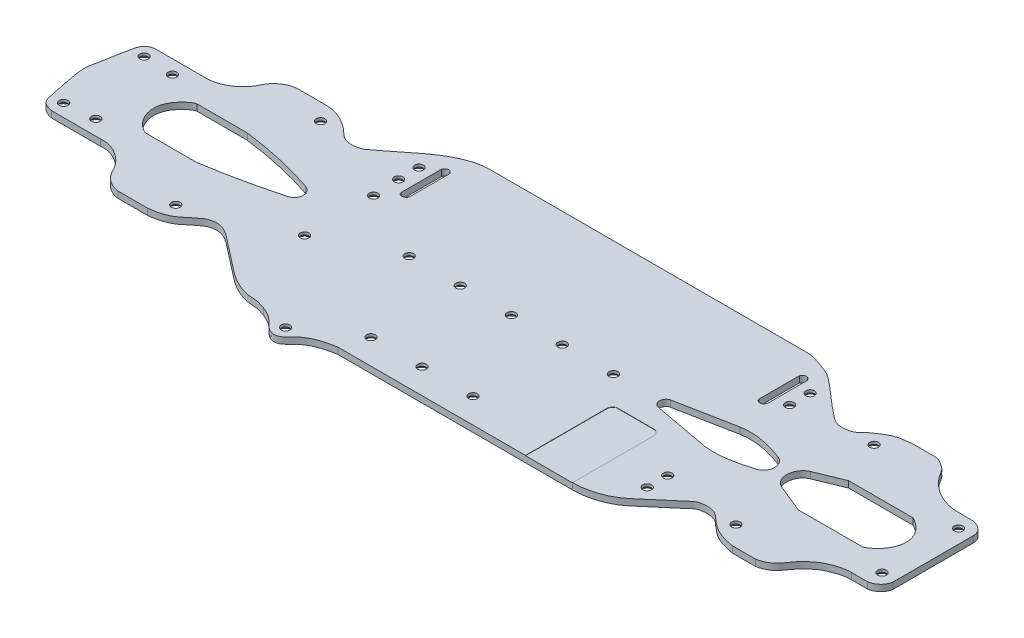
from build123d import *

# Parameters (mm, degrees)
SKETCH1_R                                      = 1.5
BOSS_EXTRUDE2_DEPTH                            = 2.5
CUT_EXTRUDE1_DEPTH                             = 0.1
CSK_FOR_M3_FLAT_HEAD_MACHINE_SCREW4_AT_2_COUNT = 2
CSK_FOR_M3_FLAT_HEAD_MACHINE_SCREW4_AT_2_PITCH = 66.233696107
CSK_FOR_M3_FLAT_HEAD_MACHINE_SCREW4_AT_3_COUNT = 2
CSK_FOR_M3_FLAT_HEAD_MACHINE_SCREW4_AT_3_PITCH = 59.212350908
CSK_FOR_M3_FLAT_HEAD_MACHINE_SCREW4_AT_4_COUNT = 2
CSK_FOR_M3_FLAT_HEAD_MACHINE_SCREW4_AT_4_PITCH = 30.175528164
CSK_FOR_M3_FLAT_HEAD_MACHINE_SCREW4_AT_5_COUNT = 2
CSK_FOR_M3_FLAT_HEAD_MACHINE_SCREW4_AT_5_PITCH = 30.373713965
CSK_FOR_M3_FLAT_HEAD_MACHINE_SCREW4_AT_6_COUNT = 2
CSK_FOR_M3_FLAT_HEAD_MACHINE_SCREW4_AT_6_PITCH = 79.728931386
CSK_FOR_M3_FLAT_HEAD_MACHINE_SCREW4_AT_7_COUNT = 2
CSK_FOR_M3_FLAT_HEAD_MACHINE_SCREW4_AT_7_PITCH = 95.332064385
CSK_FOR_M3_FLAT_HEAD_MACHINE_SCREW5_AT_2_COUNT = 2
CSK_FOR_M3_FLAT_HEAD_MACHINE_SCREW5_AT_2_PITCH = 40.263909088
CSK_FOR_M3_FLAT_HEAD_MACHINE_SCREW5_AT_3_COUNT = 2
CSK_FOR_M3_FLAT_HEAD_MACHINE_SCREW5_AT_3_PITCH = 20.000074474
CSK_FOR_M3_FLAT_HEAD_MACHINE_SCREW5_AT_4_COUNT = 2
CSK_FOR_M3_FLAT_HEAD_MACHINE_SCREW5_AT_4_PITCH = 40.000037237
CSK_FOR_M3_FLAT_HEAD_MACHINE_SCREW5_AT_5_COUNT = 2
CSK_FOR_M3_FLAT_HEAD_MACHINE_SCREW5_AT_5_PITCH = 53.114803727
CSK_FOR_M3_FLAT_HEAD_MACHINE_SCREW5_AT_6_COUNT = 2
CSK_FOR_M3_FLAT_HEAD_MACHINE_SCREW5_AT_6_PITCH = 77.053745071
CSK_FOR_M3_FLAT_HEAD_MACHINE_SCREW5_AT_7_COUNT = 2
CSK_FOR_M3_FLAT_HEAD_MACHINE_SCREW5_AT_7_PITCH = 60.000024825
CSK_FOR_M3_FLAT_HEAD_MACHINE_SCREW5_AT_8_COUNT = 2
CSK_FOR_M3_FLAT_HEAD_MACHINE_SCREW5_AT_8_PITCH = 88.519417505
CSK_FOR_M3_FLAT_HEAD_MACHINE_SCREW5_AT_9_COUNT = 2
CSK_FOR_M3_FLAT_HEAD_MACHINE_SCREW5_AT_9_PITCH = 88.551310541
CSK_FOR_M3_FLAT_HEAD_MACHINE_SCREW5_AT_1_COUNT = 2
CSK_FOR_M3_FLAT_HEAD_MACHINE_SCREW5_AT_1_PITCH = 91.311718107
CSK_FOR_M3_FLAT_HEAD_MACHINE_SCREW5_2_COUNT    = 2
CSK_FOR_M3_FLAT_HEAD_MACHINE_SCREW5_2_PITCH    = 93.73314859
CSK_FOR_M3_FLAT_HEAD_MACHINE_SCREW5_3_COUNT    = 2
CSK_FOR_M3_FLAT_HEAD_MACHINE_SCREW5_3_PITCH    = 126.345847285
CSK_FOR_M3_FLAT_HEAD_MACHINE_SCREW5_4_COUNT    = 2
CSK_FOR_M3_FLAT_HEAD_MACHINE_SCREW5_4_PITCH    = 126.29890636
CSK_FOR_M3_FLAT_HEAD_MACHINE_SCREW5_5_COUNT    = 2
CSK_FOR_M3_FLAT_HEAD_MACHINE_SCREW5_5_PITCH    = 168.546246941
CSK_FOR_M3_FLAT_HEAD_MACHINE_SCREW5_6_COUNT    = 2
CSK_FOR_M3_FLAT_HEAD_MACHINE_SCREW5_6_PITCH    = 168.591554551
CSK_FOR_M3_FLAT_HEAD_MACHINE_SCREW5_7_COUNT    = 2
CSK_FOR_M3_FLAT_HEAD_MACHINE_SCREW5_7_PITCH    = 180.298440672
CSK_FOR_M3_FLAT_HEAD_MACHINE_SCREW5_8_COUNT    = 2
CSK_FOR_M3_FLAT_HEAD_MACHINE_SCREW5_8_PITCH    = 180.28016853


with BuildPart() as part:
    # Sketch1 → Boss-Extrude2 (new body)
    # profile 1 of 35: a face of its own
    with BuildSketch(Plane(origin=(0, 0, 0), x_dir=(1, 0, 0), z_dir=(0, 1, 0))):
        with BuildLine():
            add(Edge.make_bspline(
                [(36.907488585, 54.882422047), (35.594519657, 54.56401607), (33.799338122, 52.976536828), (31.098345546, 50.096988021), (30.009509433, 47.212874354), (29.911704123, 45.283867027), (29.911219993, 44.969957828)],
                knots=[0, 0, 0, 0, 0.154255371, 0.275824704, 0.463552703, 0.499989342, 0.499989342, 0.499989342, 0.499989342], degree=3))
            Line((36.907488585, 54.882422047), (56.618968262, 54.882422047))
            add(Edge.make_bspline(
                [(56.618968262, 54.882422047), (71.670703859, 53.032810637), (86.062948094, 48.228182501)],
                knots=[0, 0, 0, 1, 1, 1], degree=2))
            add(Edge.make_bspline(
                [(86.062948094, 48.228182501), (86.868819756, 47.891547415), (88.223487764, 47.030286074), (88.720704191, 45.523685137), (88.757007412, 44.90847658)],
                knots=[0, 0, 0, 0, 0.28626646, 0.481455552, 0.481455552, 0.481455552, 0.481455552], degree=3))
            Line((88.757007412, 44.90847658), (128.601490275, 44.866847627))
            ThreePointArc((128.601490275, 44.866847627), (130.101567178, 46.299999181), (131.598646136, 44.863716241))
            Line((131.598646136, 44.863716241), (148.60070405, 44.845952731))
            ThreePointArc((148.60070405, 44.845952731), (150.101567178, 46.299999181), (151.599388699, 44.842819748))
            Line((151.599388699, 44.842819748), (168.600209308, 44.82505753))
            ThreePointArc((168.600209308, 44.82505753), (170.101567178, 46.299999181), (171.599839777, 44.821923559))
            Line((171.599839777, 44.821923559), (188.601150605, 44.804160829))
            ThreePointArc((188.601150605, 44.804160829), (190.101567178, 46.245419125), (191.598968866, 44.801028751))
            Line((191.598968866, 44.801028751), (208.600093343, 44.783266216))
            ThreePointArc((208.600093343, 44.783266216), (210.091632978, 46.299976664), (211.6, 44.8))
            ThreePointArc((211.6, 44.8), (211.599967104, 44.790065829), (211.599868416, 44.780132094))
            Line((211.599868416, 44.780132094), (228.147766177, 44.762843084))
            add(Edge.make_bspline(
                [(230.075858638, 47.193938188), (228.966952353, 46.987709042), (228.151485642, 45.873605381), (228.147766177, 44.762843084)],
                knots=[0, 0, 0, 0, 0.499360617, 0.499360617, 0.499360617, 0.499360617], degree=3))
            Line((230.075858638, 47.193938188), (252.784902126, 51.623620635))
            add(Edge.make_bspline(
                [(252.784902126, 51.623620635), (258.653577095, 52.670158948), (264.694447743, 50.965840037), (270.160470774, 49.009789661)],
                knots=[0, 0, 0, 0, 1, 1, 1, 1], degree=3))
            add(Edge.make_bspline(
                [(270.160470774, 49.009789661), (272.115204978, 48.467545141), (273.263365656, 46.599497688), (273.300093974, 44.715668569)],
                knots=[0, 0, 0, 0, 0.530351687, 0.530351687, 0.530351687, 0.530351687], degree=3))
            Line((273.300093974, 44.715668569), (278.1012549, 44.710652384))
            add(Edge.make_bspline(
                [(281.657342501, 50.311284728), (279.488273035, 49.414407256), (278.159258638, 47.062632602), (278.1012549, 44.710652384)],
                knots=[0, 0, 0, 0, 0.515708483, 0.515708483, 0.515708483, 0.515708483], degree=3))
            Line((281.657342501, 50.311284728), (292.311176152, 54.684119913))
            Line((292.311176152, 54.684119913), (317.525221457, 54.684119913))
            add(Edge.make_bspline(
                [(317.525221457, 54.684119913), (320.088023343, 53.418859666), (323.5801233, 50.408576421), (324.485491537, 46.071064208), (324.441891448, 44.712447016), (324.43983088, 44.662238494)],
                knots=[0, 0, 0, 0, 0.34763493, 0.503597702, 0.509586391, 0.509586391, 0.509586391, 0.509586391], degree=3))
            Line((324.43983088, 44.662238494), (335.337556727, 44.650852704))
            Line((335.337556727, 44.650852704), (335.337556727, 60.267166852))
            add(Edge.make_bspline(
                [(335.337556727, 60.267166852), (335.381647502, 64.063012087), (330.550085447, 65.420877221)],
                knots=[0, 0, 0, 1, 1, 1], degree=2))
            Line((330.550085447, 65.420877221), (323.870194658, 65.420877221))
            add(Edge.make_bspline(
                [(323.870194658, 65.420877221), (317.619104204, 65.56499295), (310.705850331, 69.83589089), (307.210641289, 76.198281564), (306.209643656, 77.295852609), (304.098545391, 78.764500401), (302.146747599, 79.934271199), (300.184758452, 79.721925355)],
                knots=[0, 0, 0, 0, 0.659856766, 0.730605099, 0.761699658, 0.815046018, 1, 1, 1, 1], degree=3))
            Line((300.184758452, 79.721925355), (292.311176152, 79.721925355))
            add(Edge.make_bspline(
                [(292.311176152, 79.721925355), (290.515866117, 79.532186233), (287.650872868, 79.285674879), (284.335781016, 77.834435105), (282.245880387, 76.481570477), (280.384831269, 75.294035196), (278.843910446, 73.942010968), (277.210811913, 72.22384044), (274.597389491, 71.491452203), (270.315204299, 71.198863613), (266.93581452, 74.269012769), (263.766328693, 76.706339683), (259.904133267, 80.208532645), (255.949839215, 83.596042356), (251.532307332, 86.906413114), (247.154791102, 88.449470967), (243.863905973, 89.760044875), (241.412578053, 89.987527163)],
                knots=[0, 0, 0, 0, 0.09283743, 0.14417525, 0.182810682, 0.219899914, 0.256495407, 0.287499878, 0.338956732, 0.390177904, 0.499998535, 0.551882987, 0.59706118, 0.764972191, 0.818812135, 0.876527075, 1, 1, 1, 1], degree=3))
            Line((241.412578053, 89.987527163), (116.392245976, 89.987527163))
            add(Edge.make_bspline(
                [(116.392245976, 89.987527163), (111.123803127, 89.915101741), (99.565741074, 84.787056532), (90.747410554, 76.147271316), (84.729685527, 72.011409224), (84.086237478, 71.812634222), (82.597533065, 71.351128856), (80.506216641, 71.180000703), (77.918056694, 71.729979428), (75.811657805, 73.397939488), (73.885099613, 75.321199149), (71.587400482, 76.908460503), (67.939586985, 78.963876819), (64.500177104, 79.806330829), (62.105756261, 79.725856712)],
                knots=[0, 0, 0, 0, 0.251239563, 0.591866674, 0.594713988, 0.603634623, 0.624034773, 0.670441718, 0.703262581, 0.749584159, 0.7972553, 0.835488746, 0.884027354, 1, 1, 1, 1], degree=3))
            Line((62.105756261, 79.725856712), (51.430035292, 79.725856712))
            add(Edge.make_bspline(
                [(51.430035292, 79.725856712), (48.916189055, 79.589946172), (45.895678105, 77.953052682), (43.366487698, 74.792985664), (42.523557941, 72.734485387), (39.095452586, 67.797623836), (34.015093498, 65.233723332), (29.460885553, 65.375610013)],
                knots=[0, 0, 0, 0, 0.273781437, 0.345825108, 0.439759411, 0.514564325, 1, 1, 1, 1], degree=3))
            Line((29.460885553, 65.375610013), (9.942760218, 65.375610013))
            add(Edge.make_bspline(
                [(9.942760218, 65.375610013), (9.179694159, 65.260483529), (7.421029287, 64.823378952), (5.875551354, 62.343291218), (5.213472185, 58.738361169), (4.525047277, 55.004597997), (3.667263698, 50.20010987), (2.897120538, 47.11320988), (2.840662331, 44.998240764)],
                knots=[0, 0, 0, 0, 0.050551914, 0.108721261, 0.174134793, 0.286411335, 0.351533713, 0.487562398, 0.487562398, 0.487562398, 0.487562398], degree=3))
            Line((2.840662331, 44.998240764), (29.911219993, 44.969957828))
        make_face()
        with Locations((10.5, 60.6)):
            Circle(SKETCH1_R, mode=Mode.SUBTRACT)
        with Locations((22.2, 60.00000174)):
            Circle(SKETCH1_R, mode=Mode.SUBTRACT)
        with Locations((102.6, 58.35)):
            Circle(SKETCH1_R, mode=Mode.SUBTRACT)
        with Locations((67, 73.2)):
            Circle(SKETCH1_R, mode=Mode.SUBTRACT)
        with Locations((102, 68.75)):
            Circle(SKETCH1_R, mode=Mode.SUBTRACT)
        with Locations((102, 76.75)):
            Circle(SKETCH1_R, mode=Mode.SUBTRACT)
        with BuildLine():
            Line((106.952300587, 64.863549186), (106.952300587, 80.666234777))
            add(Edge.make_bspline(
                [(106.952300587, 80.666234777), (107.178026488, 81.313115102), (108.564834934, 82.386014195), (109.877039864, 81.274789213), (110.060580104, 80.666234777)],
                knots=[0, 0, 0, 0, 0.518454887, 1, 1, 1, 1], degree=3))
            Line((110.060580104, 80.666234777), (110.060580104, 64.863549186))
            add(Edge.make_bspline(
                [(106.952300587, 64.863549186), (106.930386217, 64.303836762), (107.587346629, 63.70701542), (109.024356388, 63.566667525), (109.846624254, 64.249851069), (110.060580104, 64.863549186)],
                knots=[0, 0, 0, 0, 0.365316911, 0.535858605, 1, 1, 1, 1], degree=3))
        make_face(mode=Mode.SUBTRACT)
        with Locations((330, 60)):
            Circle(SKETCH1_R, mode=Mode.SUBTRACT)
        with BuildLine():
            Line((247.043811407, 64.863549186), (247.043811407, 80.666234777))
            add(Edge.make_bspline(
                [(247.043811407, 80.666234777), (247.30363071, 81.24405282), (248.717614816, 82.483580171), (249.929593053, 81.160687442), (250.187116738, 80.666234777)],
                knots=[0, 0, 0, 0, 0.528438548, 1, 1, 1, 1], degree=3))
            Line((250.187116738, 80.666234777), (250.187116738, 64.863549186))
            add(Edge.make_bspline(
                [(247.043811407, 64.863549186), (247.182148453, 64.156618314), (247.911677614, 63.667059472), (249.361001183, 63.591096243), (249.860698355, 64.495451031), (250.187116738, 64.863549186)],
                knots=[0, 0, 0, 0, 0.451332801, 0.577501736, 1, 1, 1, 1], degree=3))
        make_face(mode=Mode.SUBTRACT)
        with Locations((255.1, 68.8)):
            Circle(SKETCH1_R, mode=Mode.SUBTRACT)
        with Locations((255.1, 76.8)):
            Circle(SKETCH1_R, mode=Mode.SUBTRACT)
        with Locations((285.1, 71.85)):
            Circle(SKETCH1_R, mode=Mode.SUBTRACT)
    # profile 2 of 35: a face of its own
    with BuildSketch(Plane(origin=(0, 0, 0), x_dir=(1, 0, 0), z_dir=(0, 1, 0))):
        with BuildLine():
            add(Edge.make_bspline(
                [(29.911219993, 44.969957828), (29.904576398, 40.66226236), (32.800514525, 36.286690819), (36.907488585, 34.941785883)],
                knots=[0.499989342, 0.499989342, 0.499989342, 0.499989342, 1, 1, 1, 1], degree=3))
            Line((29.911219993, 44.969957828), (2.840662331, 44.998240764))
            add(Edge.make_bspline(
                [(2.840662331, 44.998240764), (2.807126594, 43.741965537), (3.095512667, 40.940086835), (4.474371186, 35.151218845), (5.069956698, 30.241003172), (6.63942442, 25.233263418), (9.254487865, 24.348293786), (10.745376335, 24.11459673)],
                knots=[0.487562398, 0.487562398, 0.487562398, 0.487562398, 0.568362381, 0.666392515, 0.86913624, 0.884827388, 1, 1, 1, 1], degree=3))
            Line((10.745376335, 24.11459673), (29.959567598, 24.11459673))
            add(Edge.make_bspline(
                [(29.959567598, 24.11459673), (32.403489975, 24.410099189), (36.070094818, 23.162399739), (40.586098003, 19.783442662), (42.506610514, 17.112962529), (43.243116967, 15.336715267)],
                knots=[0, 0, 0, 0, 0.430733706, 0.657674038, 1, 1, 1, 1], degree=3))
            add(Edge.make_bspline(
                [(43.243116967, 15.336715267), (43.785762882, 14.408733125), (45.708346841, 11.698957861), (48.83105023, 10.146084088), (51.020872515, 9.853211756)],
                knots=[0, 0, 0, 0, 0.328355163, 1, 1, 1, 1], degree=3))
            Line((51.020872515, 9.853211756), (62.554793295, 9.853211756))
            add(Edge.make_bspline(
                [(62.554793295, 9.853211756), (65.1520941, 10.09298721), (70.440020772, 11.254067041), (74.80599231, 15.730321331), (78.348452154, 18.047170805), (80.644397283, 18.411894734), (83.209459526, 18.329277997), (86.992635719, 16.413767321), (91.318616455, 12.669648109), (97.423172546, 8.159685856), (103.854698474, 2.660261878), (110.746513832, -0.097973795), (116.056689936, -0.085480028), (118.06354319, -1.049572308), (119.270928261, -1.339607968)],
                knots=[0, 0, 0, 0, 0.123327514, 0.237859837, 0.286112953, 0.315953685, 0.344320467, 0.404092563, 0.506753476, 0.610975569, 0.755967955, 0.899756711, 0.941962034, 1, 1, 1, 1], degree=3))
            add(Edge.make_bspline(
                [(119.270928261, -1.339607968), (121.355335254, -2.092163936), (123.970193737, -3.670713855), (126.552628945, -6.582493894), (128.234855066, -7.977777897), (130.438922612, -8.357035387), (132.122434415, -7.878450321), (133.832225295, -6.352336358), (137.563233554, -2.122756115), (143.104162216, -0.62280803), (147.062994102, -0.012472837)],
                knots=[0, 0, 0, 0, 0.20753547, 0.273274937, 0.364647183, 0.401236272, 0.478196474, 0.516217032, 0.613575572, 1, 1, 1, 1], degree=3))
            Line((147.062994102, -0.012472837), (220.450170586, -0.012472837))
            Line((220.450170586, -0.012472837), (220.450170586, 31.35))
            add(Edge.make_bspline(
                [(220.450170586, 31.35), (220.262122398, 33.207542057), (222, 34.056626768)],
                knots=[0, 0, 0, 1, 1, 1], degree=2))
            Line((222, 34.056626768), (237, 34.056626768))
            add(Edge.make_bspline(
                [(238.915198673, 31.35), (239.113985195, 33.403570018), (237, 34.056626768)],
                knots=[0, 0, 0, 1, 1, 1], degree=2))
            Line((238.915198673, 31.35), (238.915198673, -0.012472837))
            add(Edge.make_bspline(
                [(238.915198673, -0.012472837), (242.569073227, -0.057882886), (247.677972276, 1.047616803), (253.755028107, 4.222157183), (257.448994604, 7.372771258), (262.181477481, 11.553780238), (266.245737396, 14.828232566), (269.380468374, 17.734835519), (271.409691776, 18.231607091), (273.224746663, 18.430418914), (275.003863453, 18.210124953), (276.560628972, 17.801862819), (277.979439546, 16.876030769), (279.296710787, 15.752131157), (280.613335618, 14.503593029), (282.086292338, 13.287334144), (283.89358291, 12.194708513), (286.985868363, 10.752391105), (289.675492299, 10.208734179), (291.551206241, 9.853211756)],
                knots=[0, 0, 0, 0, 0.180867461, 0.249761684, 0.33779936, 0.419905234, 0.561880518, 0.598784303, 0.626795677, 0.663132007, 0.688825672, 0.715104021, 0.741927087, 0.771676094, 0.800829534, 0.831669371, 0.865958698, 0.90501028, 1, 1, 1, 1], degree=3))
            Line((291.551206241, 9.853211756), (300.593517722, 9.853211756))
            add(Edge.make_bspline(
                [(300.593517722, 9.853211756), (301.515930843, 9.991946943), (303.576758205, 10.656319662), (306.087291732, 12.230352829), (308.231868929, 15.26731262), (310.076702097, 17.999636552), (312.75378581, 20.049541837), (314.548448054, 21.471628153), (316.716265315, 22.442876805), (318.746853968, 23.290645605), (321.20967663, 23.963664783), (322.883615351, 24.117267848), (323.918700913, 24.118634772)],
                knots=[0, 0, 0, 0, 0.097851721, 0.229649662, 0.302406947, 0.489627767, 0.573653467, 0.657740668, 0.730731757, 0.823622625, 0.890488858, 1, 1, 1, 1], degree=3))
            Line((323.918700913, 24.118634772), (330.304230382, 24.118634772))
            add(Edge.make_bspline(
                [(330.304230382, 24.118634772), (332.751189148, 24.517348713), (334.941799919, 26.345921971), (335.337556727, 29.034538557)],
                knots=[0, 0, 0, 0, 1, 1, 1, 1], degree=3))
            Line((335.337556727, 29.034538557), (335.337556727, 44.650852704))
            Line((335.337556727, 44.650852704), (324.43983088, 44.662238494))
            add(Edge.make_bspline(
                [(324.43983088, 44.662238494), (324.27109099, 40.550663495), (321.095989495, 36.645788539), (317.525221457, 34.941785883)],
                knots=[0.509586391, 0.509586391, 0.509586391, 0.509586391, 1, 1, 1, 1], degree=3))
            Line((317.525221457, 34.941785883), (292.311176152, 34.941785883))
            Line((292.311176152, 34.941785883), (281.657342501, 39.288715272))
            add(Edge.make_bspline(
                [(278.1012549, 44.710652384), (278.04678475, 42.501954822), (279.113182334, 40.29307598), (281.657342501, 39.288715272)],
                knots=[0.515708483, 0.515708483, 0.515708483, 0.515708483, 1, 1, 1, 1], degree=3))
            Line((278.1012549, 44.710652384), (273.300093974, 44.715668569))
            add(Edge.make_bspline(
                [(273.300093974, 44.715668569), (273.332618416, 43.047460117), (272.493576093, 41.366875946), (270.57126488, 40.583629854)],
                knots=[0.530351687, 0.530351687, 0.530351687, 0.530351687, 1, 1, 1, 1], degree=3))
            add(Edge.make_bspline(
                [(252.784902126, 38.123620635), (258.796983293, 37.370186281), (264.845980862, 38.868396789), (270.57126488, 40.583629854)],
                knots=[0, 0, 0, 0, 1, 1, 1, 1], degree=3))
            Line((252.784902126, 38.123620635), (230.075858638, 42.326524066))
            add(Edge.make_bspline(
                [(228.147766177, 44.762843084), (228.147763262, 44.761972429), (228.144672178, 43.648368312), (228.957899469, 42.538840601), (230.075858638, 42.326524066)],
                knots=[0.499360617, 0.499360617, 0.499360617, 0.499360617, 0.499752034, 1, 1, 1, 1], degree=3))
            Line((228.147766177, 44.762843084), (211.599868416, 44.780132094))
            ThreePointArc((211.599868416, 44.780132094), (210.098432822, 43.300000819), (208.600093343, 44.783266216))
            Line((208.600093343, 44.783266216), (191.598968866, 44.801028751))
            ThreePointArc((191.598968866, 44.801028751), (191.599742194, 44.773229127), (191.6, 44.745419943))
            ThreePointArc((191.6, 44.745419943), (190.070623923, 43.245707622), (188.601150605, 44.804160829))
            Line((188.601150605, 44.804160829), (171.599839777, 44.821923559))
            ThreePointArc((171.599839777, 44.821923559), (171.599959944, 44.810962072), (171.6, 44.8))
            ThreePointArc((171.6, 44.8), (170.087470798, 43.300052328), (168.600209308, 44.82505753))
            Line((168.600209308, 44.82505753), (151.599388699, 44.842819748))
            ThreePointArc((151.599388699, 44.842819748), (151.599847167, 44.821412056), (151.6, 44.8))
            ThreePointArc((151.6, 44.8), (150.077020938, 43.300176023), (148.60070405, 44.845952731))
            Line((148.60070405, 44.845952731), (131.598646136, 44.863716241))
            ThreePointArc((131.598646136, 44.863716241), (131.599661496, 44.831865311), (131.6, 44.8))
            ThreePointArc((131.6, 44.8), (130.066567881, 43.300372615), (128.601490275, 44.866847627))
            Line((128.601490275, 44.866847627), (88.757007412, 44.90847658))
            add(Edge.make_bspline(
                [(88.757007412, 44.90847658), (88.761107681, 44.838991828), (88.807960384, 43.203289273), (87.668948693, 41.617492687), (86.062948094, 41.228182501)],
                knots=[0.481455552, 0.481455552, 0.481455552, 0.481455552, 0.503501191, 1, 1, 1, 1], degree=3))
            add(Edge.make_bspline(
                [(56.618968262, 34.941785883), (71.510832568, 37.284204233), (86.062948094, 41.228182501)],
                knots=[0, 0, 0, 1, 1, 1], degree=2))
            Line((56.618968262, 34.941785883), (36.907488585, 34.941785883))
        make_face()
        with Locations((130.1, -3.6)):
            Circle(SKETCH1_R, mode=Mode.SUBTRACT)
        with Locations((150.1, 9.8)):
            Circle(SKETCH1_R, mode=Mode.SUBTRACT)
        with Locations((67, 16.5)):
            Circle(SKETCH1_R, mode=Mode.SUBTRACT)
        with Locations((10.5, 29.1)):
            Circle(SKETCH1_R, mode=Mode.SUBTRACT)
        with Locations((22.2, 30.00000174)):
            Circle(SKETCH1_R, mode=Mode.SUBTRACT)
        with Locations((102.6, 31.35)):
            Circle(SKETCH1_R, mode=Mode.SUBTRACT)
        with Locations((170.1, 9.8)):
            Circle(SKETCH1_R, mode=Mode.SUBTRACT)
        with Locations((190.1, 9.8)):
            Circle(SKETCH1_R, mode=Mode.SUBTRACT)
        with Locations((255.1, 13)):
            Circle(SKETCH1_R, mode=Mode.SUBTRACT)
        with Locations((255.1, 21)):
            Circle(SKETCH1_R, mode=Mode.SUBTRACT)
        with Locations((285.1, 17.75)):
            Circle(SKETCH1_R, mode=Mode.SUBTRACT)
        with Locations((330, 30)):
            Circle(SKETCH1_R, mode=Mode.SUBTRACT)
    # profile 3 of 35: a face of its own
    with BuildSketch(Plane(origin=(0, 0, 0), x_dir=(1, 0, 0), z_dir=(0, 1, 0))):
        with BuildLine():
            ThreePointArc((131.598646136, 44.863716241), (130.101567178, 46.299999181), (128.601490275, 44.866847627))
            Line((128.601490275, 44.866847627), (131.598646136, 44.863716241))
        make_face()
    # profile 4 of 35: a face of its own
    with BuildSketch(Plane(origin=(0, 0, 0), x_dir=(1, 0, 0), z_dir=(0, 1, 0))):
        with BuildLine():
            Line((131.598646136, 44.863716241), (128.601490275, 44.866847627))
            ThreePointArc((128.601490275, 44.866847627), (130.066567881, 43.300372615), (131.6, 44.8))
            ThreePointArc((131.6, 44.8), (131.599661496, 44.831865311), (131.598646136, 44.863716241))
        make_face()
    # profile 5 of 35: a face of its own
    with BuildSketch(Plane(origin=(0, 0, 0), x_dir=(1, 0, 0), z_dir=(0, 1, 0))):
        with BuildLine():
            ThreePointArc((151.599388699, 44.842819748), (150.101567178, 46.299999181), (148.60070405, 44.845952731))
            Line((148.60070405, 44.845952731), (151.599388699, 44.842819748))
        make_face()
    # profile 6 of 35: a face of its own
    with BuildSketch(Plane(origin=(0, 0, 0), x_dir=(1, 0, 0), z_dir=(0, 1, 0))):
        with BuildLine():
            Line((151.599388699, 44.842819748), (148.60070405, 44.845952731))
            ThreePointArc((148.60070405, 44.845952731), (150.077020938, 43.300176023), (151.6, 44.8))
            ThreePointArc((151.6, 44.8), (151.599847167, 44.821412056), (151.599388699, 44.842819748))
        make_face()
    # profile 7 of 35: a face of its own
    with BuildSketch(Plane(origin=(0, 0, 0), x_dir=(1, 0, 0), z_dir=(0, 1, 0))):
        with BuildLine():
            ThreePointArc((171.599839777, 44.821923559), (170.101567178, 46.299999181), (168.600209308, 44.82505753))
            Line((168.600209308, 44.82505753), (171.599839777, 44.821923559))
        make_face()
    # profile 8 of 35: a face of its own
    with BuildSketch(Plane(origin=(0, 0, 0), x_dir=(1, 0, 0), z_dir=(0, 1, 0))):
        with BuildLine():
            Line((171.599839777, 44.821923559), (168.600209308, 44.82505753))
            ThreePointArc((168.600209308, 44.82505753), (170.087470798, 43.300052328), (171.6, 44.8))
            ThreePointArc((171.6, 44.8), (171.599959944, 44.810962072), (171.599839777, 44.821923559))
        make_face()
    # profile 9 of 35: a face of its own
    with BuildSketch(Plane(origin=(0, 0, 0), x_dir=(1, 0, 0), z_dir=(0, 1, 0))):
        with BuildLine():
            ThreePointArc((191.598968866, 44.801028751), (190.101567178, 46.245419125), (188.601150605, 44.804160829))
            Line((188.601150605, 44.804160829), (191.598968866, 44.801028751))
        make_face()
    # profile 10 of 35: a face of its own
    with BuildSketch(Plane(origin=(0, 0, 0), x_dir=(1, 0, 0), z_dir=(0, 1, 0))):
        with BuildLine():
            Line((191.598968866, 44.801028751), (188.601150605, 44.804160829))
            ThreePointArc((188.601150605, 44.804160829), (190.070623923, 43.245707622), (191.6, 44.745419943))
            ThreePointArc((191.6, 44.745419943), (191.599742194, 44.773229127), (191.598968866, 44.801028751))
        make_face()
    # profile 11 of 35: a face of its own
    with BuildSketch(Plane(origin=(0, 0, 0), x_dir=(1, 0, 0), z_dir=(0, 1, 0))):
        with BuildLine():
            Line((220.450170586, 31.35), (220.450170586, -0.012472837))
            Line((220.450170586, -0.012472837), (238.915198673, -0.012472837))
            Line((238.915198673, -0.012472837), (238.915198673, 31.35))
            add(Edge.make_bspline(
                [(238.915198673, 31.35), (239.113985195, 33.403570018), (237, 34.056626768)],
                knots=[0, 0, 0, 1, 1, 1], degree=2))
            Line((237, 34.056626768), (222, 34.056626768))
            add(Edge.make_bspline(
                [(220.450170586, 31.35), (220.262122398, 33.207542057), (222, 34.056626768)],
                knots=[0, 0, 0, 1, 1, 1], degree=2))
        make_face()
    # profile 12 of 35: a face of its own
    with BuildSketch(Plane(origin=(0, 0, 0), x_dir=(1, 0, 0), z_dir=(0, 1, 0))):
        with BuildLine():
            ThreePointArc((211.6, 44.8), (210.091632978, 46.299976664), (208.600093343, 44.783266216))
            Line((208.600093343, 44.783266216), (211.599868416, 44.780132094))
            ThreePointArc((211.599868416, 44.780132094), (211.599967104, 44.790065829), (211.6, 44.8))
        make_face()
    # profile 13 of 35: a face of its own
    with BuildSketch(Plane(origin=(0, 0, 0), x_dir=(1, 0, 0), z_dir=(0, 1, 0))):
        with BuildLine():
            Line((211.599868416, 44.780132094), (208.600093343, 44.783266216))
            ThreePointArc((208.600093343, 44.783266216), (210.098432822, 43.300000819), (211.599868416, 44.780132094))
        make_face()
    # profile 14 of 35: a face of its own
    with BuildSketch(Plane(origin=(0, 0, 0), x_dir=(1, 0, 0), z_dir=(0, 1, 0))):
        with Locations((255.1, 13)):
            Circle(SKETCH1_R)
    # profile 15 of 35: a face of its own
    with BuildSketch(Plane(origin=(0, 0, 0), x_dir=(1, 0, 0), z_dir=(0, 1, 0))):
        with Locations((255.1, 21)):
            Circle(SKETCH1_R)
    # profile 16 of 35: a face of its own
    with BuildSketch(Plane(origin=(0, 0, 0), x_dir=(1, 0, 0), z_dir=(0, 1, 0))):
        with Locations((255.1, 68.8)):
            Circle(SKETCH1_R)
    # profile 17 of 35: a face of its own
    with BuildSketch(Plane(origin=(0, 0, 0), x_dir=(1, 0, 0), z_dir=(0, 1, 0))):
        with Locations((255.1, 76.8)):
            Circle(SKETCH1_R)
    # profile 18 of 35: a face of its own
    with BuildSketch(Plane(origin=(0, 0, 0), x_dir=(1, 0, 0), z_dir=(0, 1, 0))):
        with Locations((285.1, 71.85)):
            Circle(SKETCH1_R)
    # profile 19 of 35: a face of its own
    with BuildSketch(Plane(origin=(0, 0, 0), x_dir=(1, 0, 0), z_dir=(0, 1, 0))):
        with Locations((285.1, 17.75)):
            Circle(SKETCH1_R)
    # profile 20 of 35: a face of its own
    with BuildSketch(Plane(origin=(0, 0, 0), x_dir=(1, 0, 0), z_dir=(0, 1, 0))):
        with Locations((170.1, 9.8)):
            Circle(SKETCH1_R)
    # profile 21 of 35: a face of its own
    with BuildSketch(Plane(origin=(0, 0, 0), x_dir=(1, 0, 0), z_dir=(0, 1, 0))):
        with Locations((150.1, 9.8)):
            Circle(SKETCH1_R)
    # profile 22 of 35: a face of its own
    with BuildSketch(Plane(origin=(0, 0, 0), x_dir=(1, 0, 0), z_dir=(0, 1, 0))):
        with Locations((130.1, -3.6)):
            Circle(SKETCH1_R)
    # profile 23 of 35: a face of its own
    with BuildSketch(Plane(origin=(0, 0, 0), x_dir=(1, 0, 0), z_dir=(0, 1, 0))):
        with Locations((102.6, 31.35)):
            Circle(SKETCH1_R)
    # profile 24 of 35: a face of its own
    with BuildSketch(Plane(origin=(0, 0, 0), x_dir=(1, 0, 0), z_dir=(0, 1, 0))):
        with Locations((102.6, 58.35)):
            Circle(SKETCH1_R)
    # profile 25 of 35: a face of its own
    with BuildSketch(Plane(origin=(0, 0, 0), x_dir=(1, 0, 0), z_dir=(0, 1, 0))):
        with Locations((102, 68.75)):
            Circle(SKETCH1_R)
    # profile 26 of 35: a face of its own
    with BuildSketch(Plane(origin=(0, 0, 0), x_dir=(1, 0, 0), z_dir=(0, 1, 0))):
        with Locations((102, 76.75)):
            Circle(SKETCH1_R)
    # profile 27 of 35: a face of its own
    with BuildSketch(Plane(origin=(0, 0, 0), x_dir=(1, 0, 0), z_dir=(0, 1, 0))):
        with Locations((67, 73.2)):
            Circle(SKETCH1_R)
    # profile 28 of 35: a face of its own
    with BuildSketch(Plane(origin=(0, 0, 0), x_dir=(1, 0, 0), z_dir=(0, 1, 0))):
        with Locations((67, 16.5)):
            Circle(SKETCH1_R)
    # profile 29 of 35: a face of its own
    with BuildSketch(Plane(origin=(0, 0, 0), x_dir=(1, 0, 0), z_dir=(0, 1, 0))):
        with Locations((22.2, 30.00000174)):
            Circle(SKETCH1_R)
    # profile 30 of 35: a face of its own
    with BuildSketch(Plane(origin=(0, 0, 0), x_dir=(1, 0, 0), z_dir=(0, 1, 0))):
        with Locations((10.5, 29.1)):
            Circle(SKETCH1_R)
    # profile 31 of 35: a face of its own
    with BuildSketch(Plane(origin=(0, 0, 0), x_dir=(1, 0, 0), z_dir=(0, 1, 0))):
        with Locations((10.5, 60.6)):
            Circle(SKETCH1_R)
    # profile 32 of 35: a face of its own
    with BuildSketch(Plane(origin=(0, 0, 0), x_dir=(1, 0, 0), z_dir=(0, 1, 0))):
        with Locations((22.2, 60.00000174)):
            Circle(SKETCH1_R)
    # profile 33 of 35: a face of its own
    with BuildSketch(Plane(origin=(0, 0, 0), x_dir=(1, 0, 0), z_dir=(0, 1, 0))):
        with Locations((330, 60)):
            Circle(SKETCH1_R)
    # profile 34 of 35: a face of its own
    with BuildSketch(Plane(origin=(0, 0, 0), x_dir=(1, 0, 0), z_dir=(0, 1, 0))):
        with Locations((330, 30)):
            Circle(SKETCH1_R)
    # profile 35 of 35: a face of its own
    with BuildSketch(Plane(origin=(0, 0, 0), x_dir=(1, 0, 0), z_dir=(0, 1, 0))):
        with Locations((190.1, 9.8)):
            Circle(SKETCH1_R)
    extrude(amount=BOSS_EXTRUDE2_DEPTH)

    # Sketch3 → Cut-Extrude1 (cut)
    with BuildSketch(Plane(origin=(0, 2.5, 0), x_dir=(1, 0, 0), z_dir=(0, 1, 0))):
        with BuildLine():
            Line((220.450170586, -0.012472837), (220.450170586, 31.35))
            add(Edge.make_bspline(
                [(220.450170586, 31.35), (220.270560546, 33.22373717), (222, 34.056626768)],
                knots=[0, 0, 0, 1, 1, 1], degree=2))
            Line((222, 34.056626768), (237, 34.056626768))
            add(Edge.make_bspline(
                [(238.915198673, 31.35), (239.113985195, 33.403570018), (237, 34.056626768)],
                knots=[0, 0, 0, 1, 1, 1], degree=2))
            Line((238.915198673, 31.35), (238.915198673, -0.012472837))
            Line((238.915198673, -0.012472837), (220.450170586, -0.012472837))
        make_face()
    extrude(amount=-CUT_EXTRUDE1_DEPTH, mode=Mode.SUBTRACT)

    # Sketch8 → CSK for M3 Flat Head Machine Screw2 (revolve, cut)
    with BuildSketch(Plane(origin=(330, 0, -60), x_dir=(0, 0, -1), z_dir=(1, 0, 0))):
        Polygon((0, 0), (0, 2.500025), (1.7, 2.500025), (1.7, 1.45), (3.15, 0), align=None)
    revolve(axis=Axis((330, -6.35, -60), (0, 1, 0)), mode=Mode.SUBTRACT)

    # Sketch14 → CSK for M3 Flat Head Machine Screw1 (revolve, cut)
    with BuildSketch(Plane(origin=(330, 0, -30), x_dir=(0, 0, -1), z_dir=(1, 0, 0))):
        Polygon((0, 0), (0, 2.500025), (1.7, 2.500025), (1.7, 1.45), (3.15, 0), align=None)
    revolve(axis=Axis((330, -6.35, -30), (0, 1, 0)), mode=Mode.SUBTRACT)

    # Sketch17 → CSK for M3 Flat Head Machine Screw3 (revolve, cut)
    with BuildSketch(Plane(origin=(285.1, 0, -71.85), x_dir=(0, 0, -1), z_dir=(1, 0, 0))):
        Polygon((0, 0), (0, 2.500025), (1.7, 2.500025), (1.7, 1.45), (3.15, 0), align=None)
    revolve(axis=Axis((285.1, -6.35, -71.85), (0, 1, 0)), mode=Mode.SUBTRACT)

    # Sketch19 → CSK for M3 Flat Head Machine Screw4 (revolve, cut)
    with BuildSketch(Plane(origin=(285.1, 0, -17.75), x_dir=(0, 0, -1), z_dir=(1, 0, 0))):
        Polygon((0, 0), (0, 2.500025), (1.7, 2.500025), (1.7, 1.45), (3.15, 0), align=None)
    csk_for_m3_flat_head_machine_screw4 = revolve(axis=Axis((285.1, -6.35, -17.75), (0, 1, 0)), mode=Mode.SUBTRACT)

    # CSK for M3 Flat Head Machine Screw4 at 2: CSK for M3 Flat Head Machine Screw4 ×2
    with Locations(*[Vector(-0.45294165603435765, 0, -0.8915401596276264) * (i * CSK_FOR_M3_FLAT_HEAD_MACHINE_SCREW4_AT_2_PITCH) for i in range(1, CSK_FOR_M3_FLAT_HEAD_MACHINE_SCREW4_AT_2_COUNT)]):
        add(csk_for_m3_flat_head_machine_screw4, mode=Mode.SUBTRACT)

    # CSK for M3 Flat Head Machine Screw4 at 3: CSK for M3 Flat Head Machine Screw4 ×2
    with Locations(*[Vector(-0.5066510540484187, 0, -0.862151210305725) * (i * CSK_FOR_M3_FLAT_HEAD_MACHINE_SCREW4_AT_3_PITCH) for i in range(1, CSK_FOR_M3_FLAT_HEAD_MACHINE_SCREW4_AT_3_COUNT)]):
        add(csk_for_m3_flat_head_machine_screw4, mode=Mode.SUBTRACT)

    # CSK for M3 Flat Head Machine Screw4 at 4: CSK for M3 Flat Head Machine Screw4 ×2
    with Locations(*[Vector(-0.9941830955390242, 0, -0.10770316868339418) * (i * CSK_FOR_M3_FLAT_HEAD_MACHINE_SCREW4_AT_4_PITCH) for i in range(1, CSK_FOR_M3_FLAT_HEAD_MACHINE_SCREW4_AT_4_COUNT)]):
        add(csk_for_m3_flat_head_machine_screw4, mode=Mode.SUBTRACT)

    # CSK for M3 Flat Head Machine Screw4 at 5: CSK for M3 Flat Head Machine Screw4 ×2
    with Locations(*[Vector(-0.9876961386749972, 0, 0.1563852219568744) * (i * CSK_FOR_M3_FLAT_HEAD_MACHINE_SCREW4_AT_5_PITCH) for i in range(1, CSK_FOR_M3_FLAT_HEAD_MACHINE_SCREW4_AT_5_COUNT)]):
        add(csk_for_m3_flat_head_machine_screw4, mode=Mode.SUBTRACT)

    # CSK for M3 Flat Head Machine Screw4 at 6: CSK for M3 Flat Head Machine Screw4 ×2
    with Locations(*[Vector(-0.94068738531839, 0, -0.33927458363816587) * (i * CSK_FOR_M3_FLAT_HEAD_MACHINE_SCREW4_AT_6_PITCH) for i in range(1, CSK_FOR_M3_FLAT_HEAD_MACHINE_SCREW4_AT_6_COUNT)]):
        add(csk_for_m3_flat_head_machine_screw4, mode=Mode.SUBTRACT)

    # CSK for M3 Flat Head Machine Screw4 at 7: CSK for M3 Flat Head Machine Screw4 ×2
    with Locations(*[Vector(-0.9965167607810174, 0, 0.08339271840220089) * (i * CSK_FOR_M3_FLAT_HEAD_MACHINE_SCREW4_AT_7_PITCH) for i in range(1, CSK_FOR_M3_FLAT_HEAD_MACHINE_SCREW4_AT_7_COUNT)]):
        add(csk_for_m3_flat_head_machine_screw4, mode=Mode.SUBTRACT)

    # Sketch21 → CSK for M3 Flat Head Machine Screw5 (revolve, cut)
    with BuildSketch(Plane(origin=(190.1, 0, -44.745419943), x_dir=(0, 0, -1), z_dir=(1, 0, 0))):
        Polygon((0, 0), (0, 2.500025), (1.7, 2.500025), (1.7, 1.45), (3.15, 0), align=None)
    csk_for_m3_flat_head_machine_screw5 = revolve(axis=Axis((190.1, -6.35, -44.745419943), (0, 1, 0)), mode=Mode.SUBTRACT)

    # CSK for M3 Flat Head Machine Screw5 at 2: CSK for M3 Flat Head Machine Screw5 ×2
    with Locations(*[Vector(-0.4967227587499056, 0, 0.8679092699930581) * (i * CSK_FOR_M3_FLAT_HEAD_MACHINE_SCREW5_AT_2_PITCH) for i in range(1, CSK_FOR_M3_FLAT_HEAD_MACHINE_SCREW5_AT_2_COUNT)]):
        add(csk_for_m3_flat_head_machine_screw5, mode=Mode.SUBTRACT)

    # CSK for M3 Flat Head Machine Screw5 at 3: CSK for M3 Flat Head Machine Screw5 ×2
    with Locations(*[Vector(-0.999996276292549, 0, -0.0027289926779032786) * (i * CSK_FOR_M3_FLAT_HEAD_MACHINE_SCREW5_AT_3_PITCH) for i in range(1, CSK_FOR_M3_FLAT_HEAD_MACHINE_SCREW5_AT_3_COUNT)]):
        add(csk_for_m3_flat_head_machine_screw5, mode=Mode.SUBTRACT)

    # CSK for M3 Flat Head Machine Screw5 at 4: CSK for M3 Flat Head Machine Screw5 ×2
    with Locations(*[Vector(-0.9999990690692374, 0, -0.001364500149699041) * (i * CSK_FOR_M3_FLAT_HEAD_MACHINE_SCREW5_AT_4_PITCH) for i in range(1, CSK_FOR_M3_FLAT_HEAD_MACHINE_SCREW5_AT_4_COUNT)]):
        add(csk_for_m3_flat_head_machine_screw5, mode=Mode.SUBTRACT)

    # CSK for M3 Flat Head Machine Screw5 at 5: CSK for M3 Flat Head Machine Screw5 ×2
    with Locations(*[Vector(-0.7530857160885897, 0, 0.657922415048565) * (i * CSK_FOR_M3_FLAT_HEAD_MACHINE_SCREW5_AT_5_PITCH) for i in range(1, CSK_FOR_M3_FLAT_HEAD_MACHINE_SCREW5_AT_5_COUNT)]):
        add(csk_for_m3_flat_head_machine_screw5, mode=Mode.SUBTRACT)

    # CSK for M3 Flat Head Machine Screw5 at 6: CSK for M3 Flat Head Machine Screw5 ×2
    with Locations(*[Vector(-0.7786772718785258, 0, 0.6274246618199006) * (i * CSK_FOR_M3_FLAT_HEAD_MACHINE_SCREW5_AT_6_PITCH) for i in range(1, CSK_FOR_M3_FLAT_HEAD_MACHINE_SCREW5_AT_6_COUNT)]):
        add(csk_for_m3_flat_head_machine_screw5, mode=Mode.SUBTRACT)

    # CSK for M3 Flat Head Machine Screw5 at 7: CSK for M3 Flat Head Machine Screw5 ×2
    with Locations(*[Vector(-0.9999995862526798, 0, -0.0009096672299877527) * (i * CSK_FOR_M3_FLAT_HEAD_MACHINE_SCREW5_AT_7_PITCH) for i in range(1, CSK_FOR_M3_FLAT_HEAD_MACHINE_SCREW5_AT_7_COUNT)]):
        add(csk_for_m3_flat_head_machine_screw5, mode=Mode.SUBTRACT)

    # CSK for M3 Flat Head Machine Screw5 at 8: CSK for M3 Flat Head Machine Screw5 ×2
    with Locations(*[Vector(-0.9884836848919483, 0, 0.1513274750414993) * (i * CSK_FOR_M3_FLAT_HEAD_MACHINE_SCREW5_AT_8_PITCH) for i in range(1, CSK_FOR_M3_FLAT_HEAD_MACHINE_SCREW5_AT_8_COUNT)]):
        add(csk_for_m3_flat_head_machine_screw5, mode=Mode.SUBTRACT)

    # CSK for M3 Flat Head Machine Screw5 at 9: CSK for M3 Flat Head Machine Screw5 ×2
    with Locations(*[Vector(-0.988127668189898, 0, -0.15363499392259217) * (i * CSK_FOR_M3_FLAT_HEAD_MACHINE_SCREW5_AT_9_PITCH) for i in range(1, CSK_FOR_M3_FLAT_HEAD_MACHINE_SCREW5_AT_9_COUNT)]):
        add(csk_for_m3_flat_head_machine_screw5, mode=Mode.SUBTRACT)

    # CSK for M3 Flat Head Machine Screw5 at 1: CSK for M3 Flat Head Machine Screw5 ×2
    with Locations(*[Vector(-0.9648268790265677, 0, -0.2628860846599775) * (i * CSK_FOR_M3_FLAT_HEAD_MACHINE_SCREW5_AT_1_PITCH) for i in range(1, CSK_FOR_M3_FLAT_HEAD_MACHINE_SCREW5_AT_1_COUNT)]):
        add(csk_for_m3_flat_head_machine_screw5, mode=Mode.SUBTRACT)

    # CSK for M3 Flat Head Machine Screw5  2: CSK for M3 Flat Head Machine Screw5 ×2
    with Locations(*[Vector(-0.9399022792382102, 0, -0.3414435611968946) * (i * CSK_FOR_M3_FLAT_HEAD_MACHINE_SCREW5_2_PITCH) for i in range(1, CSK_FOR_M3_FLAT_HEAD_MACHINE_SCREW5_2_COUNT)]):
        add(csk_for_m3_flat_head_machine_screw5, mode=Mode.SUBTRACT)

    # CSK for M3 Flat Head Machine Screw5  3: CSK for M3 Flat Head Machine Screw5 ×2
    with Locations(*[Vector(-0.9743098221673347, 0, -0.2252118345652743) * (i * CSK_FOR_M3_FLAT_HEAD_MACHINE_SCREW5_3_PITCH) for i in range(1, CSK_FOR_M3_FLAT_HEAD_MACHINE_SCREW5_3_COUNT)]):
        add(csk_for_m3_flat_head_machine_screw5, mode=Mode.SUBTRACT)

    # CSK for M3 Flat Head Machine Screw5  4: CSK for M3 Flat Head Machine Screw5 ×2
    with Locations(*[Vector(-0.9746719393513993, 0, 0.22363946575008264) * (i * CSK_FOR_M3_FLAT_HEAD_MACHINE_SCREW5_4_PITCH) for i in range(1, CSK_FOR_M3_FLAT_HEAD_MACHINE_SCREW5_4_COUNT)]):
        add(csk_for_m3_flat_head_machine_screw5, mode=Mode.SUBTRACT)

    # CSK for M3 Flat Head Machine Screw5  5: CSK for M3 Flat Head Machine Screw5 ×2
    with Locations(*[Vector(-0.9961657589356591, 0, 0.08748588871436529) * (i * CSK_FOR_M3_FLAT_HEAD_MACHINE_SCREW5_5_PITCH) for i in range(1, CSK_FOR_M3_FLAT_HEAD_MACHINE_SCREW5_5_COUNT)]):
        add(csk_for_m3_flat_head_machine_screw5, mode=Mode.SUBTRACT)

    # CSK for M3 Flat Head Machine Screw5  6: CSK for M3 Flat Head Machine Screw5 ×2
    with Locations(*[Vector(-0.9958980474883715, 0, -0.09048247901582628) * (i * CSK_FOR_M3_FLAT_HEAD_MACHINE_SCREW5_6_PITCH) for i in range(1, CSK_FOR_M3_FLAT_HEAD_MACHINE_SCREW5_6_COUNT)]):
        add(csk_for_m3_flat_head_machine_screw5, mode=Mode.SUBTRACT)

    # CSK for M3 Flat Head Machine Screw5  7: CSK for M3 Flat Head Machine Screw5 ×2
    with Locations(*[Vector(-0.9961261968242235, 0, -0.08793520341995319) * (i * CSK_FOR_M3_FLAT_HEAD_MACHINE_SCREW5_7_PITCH) for i in range(1, CSK_FOR_M3_FLAT_HEAD_MACHINE_SCREW5_7_COUNT)]):
        add(csk_for_m3_flat_head_machine_screw5, mode=Mode.SUBTRACT)

    # CSK for M3 Flat Head Machine Screw5  8: CSK for M3 Flat Head Machine Screw5 ×2
    with Locations(*[Vector(-0.9962271583417671, 0, 0.08678392121981918) * (i * CSK_FOR_M3_FLAT_HEAD_MACHINE_SCREW5_8_PITCH) for i in range(1, CSK_FOR_M3_FLAT_HEAD_MACHINE_SCREW5_8_COUNT)]):
        add(csk_for_m3_flat_head_machine_screw5, mode=Mode.SUBTRACT)


solid = part.part
